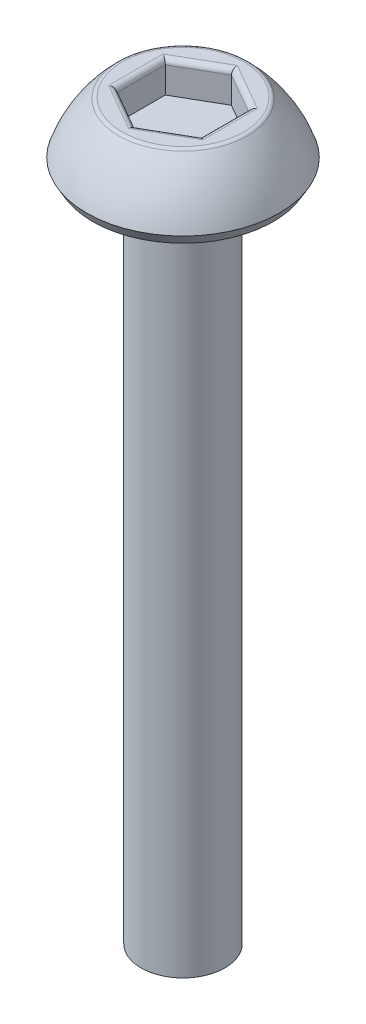
from build123d import *

# Parameters (mm, degrees)
CUT_EXTRUDE1_DEPTH = 0.75
FILLET1_R          = 0.125


with BuildPart() as part:
    # Sketch1 → Revolve1 (revolve)
    with BuildSketch(Plane(origin=(0, 0, 0), x_dir=(0, 0, -1), z_dir=(1, 0, 0)), mode=Mode.PRIVATE) as revolve1_sk:
        with BuildLine():
            Line((0, 1.5), (-1.5, 1.5))
            ThreePointArc((-1.5, 1.5), (-1.978515811, 0.925250119), (-2.3, 0.25))
            Line((-2.3, 0.25), (-2.155662433, 0))
            Line((-2.155662433, 0), (-1, 0))
            Line((-1, 0), (-1, -16))
            Line((-1, -16), (0, -16))
            Line((0, -16), (0, 1.5))
        make_face()
    revolve(revolve1_sk.sketch.rotate(Axis((0, -16, 0), (0, 1, 0)), 180), axis=Axis((0, -16, 0), (0, 1, 0)))

    # Sketch2 → Cut-Extrude1 (cut)
    with BuildSketch(Plane(origin=(0, 1.5, 0), x_dir=(1, 0, 0), z_dir=(0, 1, 0))):
        Polygon((0, 1.154700538), (-1, 0.577350269), (-1, -0.577350269), (0, -1.154700538), (1, -0.577350269), (1, 0.577350269), align=None)
    extrude(amount=-CUT_EXTRUDE1_DEPTH, mode=Mode.SUBTRACT)

    # Fillet1
    fillet1_edges = [part.edges().sort_by_distance(p)[0] for p in [
        (0.5, 1.5, -0.866025404),
        (-0.5, 1.5, -0.866025404),
        (-1, 1.5, 0),
        (-0.5, 1.5, 0.866025404),
        (0.5, 1.5, 0.866025404),
        (1, 1.5, 0),
        (0, 1.5, 1.5),
    ]]
    fillet(fillet1_edges, radius=FILLET1_R)


solid = part.part
